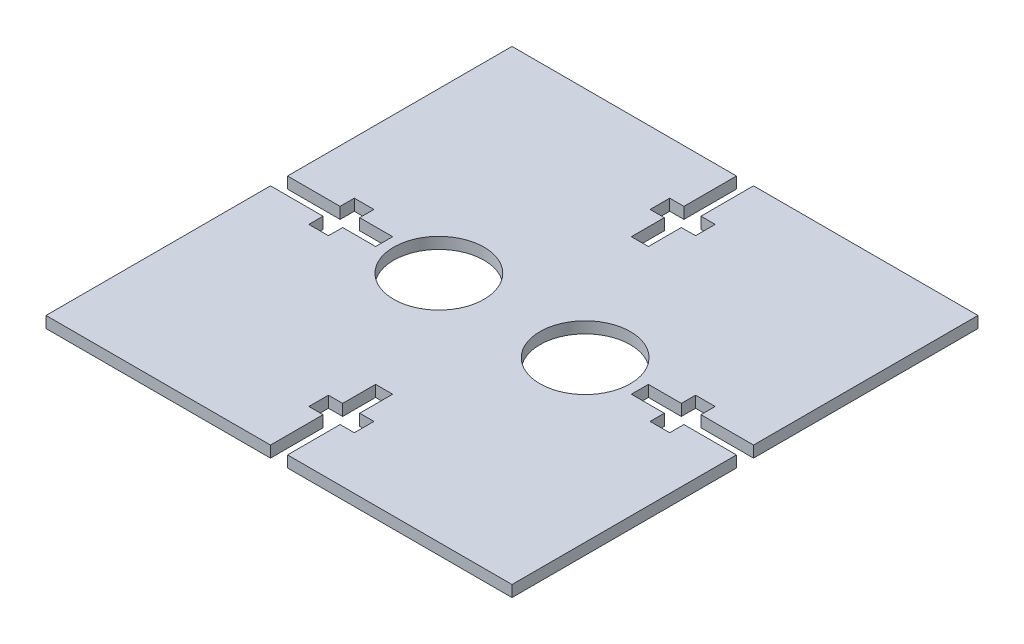
from build123d import *

# Parameters (mm, degrees)
SKETCH1_W           = 82
SKETCH1_H           = 82
BOSS_EXTRUDE1_DEPTH = 2
SKETCH2_R           = 7.955
CUT_EXTRUDE1_DEPTH  = 10
CUT_EXTRUDE4_DEPTH  = 10


with BuildPart() as part:
    # Sketch1 → Boss-Extrude1 (new body)
    with BuildSketch(Plane(origin=(0, 0, 0), x_dir=(1, 0, 0), z_dir=(0, 1, 0))):
        Rectangle(SKETCH1_W, SKETCH1_H)
    extrude(amount=BOSS_EXTRUDE1_DEPTH)

    # Sketch2 → Cut-Extrude1 (cut)
    with BuildSketch(Plane(origin=(0, 2, 0), x_dir=(1, 0, 0), z_dir=(0, 1, 0))):
        with Locations(Location((-12.87, 0, 0), (0, 0, 270))):
            Circle(SKETCH2_R)
        with Locations(Location((12.87, 0, 0), (0, 0, 270))):
            Circle(SKETCH2_R)
    extrude(amount=-CUT_EXTRUDE1_DEPTH, mode=Mode.SUBTRACT)

    # Sketch6 → Cut-Extrude4 (cut)
    with BuildSketch(Plane(origin=(0, 2, 0), x_dir=(1, 0, 0), z_dir=(0, 1, 0))):
        Polygon((-1.5, 22.5), (1.5, 22.5), (1.5, 28.3), (4, 28.3), (4, 31.75), (1.5, 31.75), (1.5, 41), (-1.5, 41), (-1.5, 31.75), (-4, 31.75), (-4, 28.3), (-1.5, 28.3), align=None)
        Polygon((28.3, 1.5), (28.3, 4), (31.75, 4), (31.75, 1.5), (41, 1.5), (41, -1.5), (31.75, -1.5), (31.75, -4), (28.3, -4), (28.3, -1.5), (22.5, -1.5), (22.5, 1.5), align=None)
        Polygon((1.5, -28.3), (4, -28.3), (4, -31.75), (1.5, -31.75), (1.5, -41), (-1.5, -41), (-1.5, -31.75), (-4, -31.75), (-4, -28.3), (-1.5, -28.3), (-1.5, -22.5), (1.5, -22.5), align=None)
        Polygon((-28.3, -1.5), (-28.3, -4), (-31.75, -4), (-31.75, -1.5), (-41, -1.5), (-41, 1.5), (-31.75, 1.5), (-31.75, 4), (-28.3, 4), (-28.3, 1.5), (-22.5, 1.5), (-22.5, -1.5), align=None)
    extrude(amount=-CUT_EXTRUDE4_DEPTH, mode=Mode.SUBTRACT)


solid = part.part
